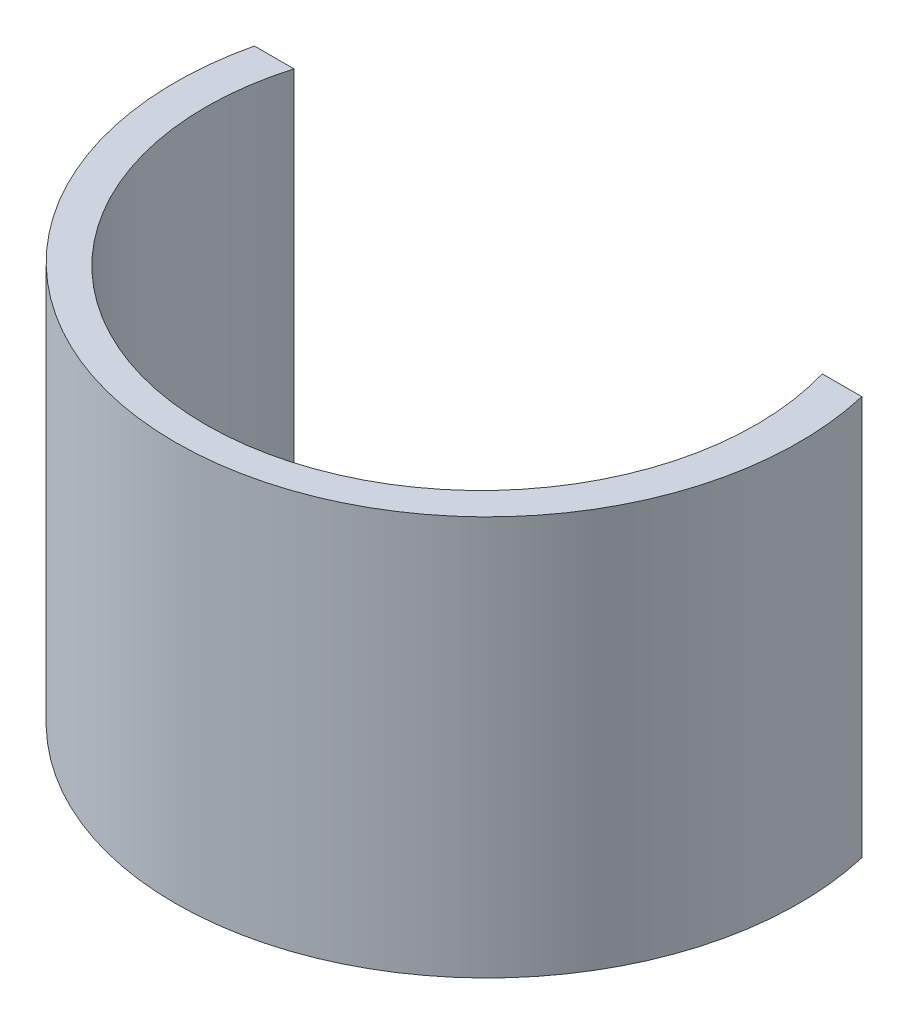
from build123d import *

# Parameters (mm, degrees)
BOSS_EXTRUDE5_DEPTH      = 70
BOSS_EXTRUDE5_DEPTH_BACK = 31


with BuildPart() as part:
    # Sketch40 → Boss-Extrude5 (new, two sides: drawn at the far end of the back side and taken through both)
    with BuildSketch(Plane(origin=(0, 0, 0), x_dir=(1, 0, 0), z_dir=(0, 1, 0)).offset(-BOSS_EXTRUDE5_DEPTH_BACK)):
        with BuildLine():
            Line((76.805, 20), (66.805, 20))
            ThreePointArc((66.805, 20), (0, -69.098010198), (-66.805, 20))
            Line((-66.805, 20), (-76.805, 20))
            ThreePointArc((-76.805, 20), (0, -76.805), (76.805, 20))
        make_face()
    extrude(amount=BOSS_EXTRUDE5_DEPTH + BOSS_EXTRUDE5_DEPTH_BACK)


solid = part.part
